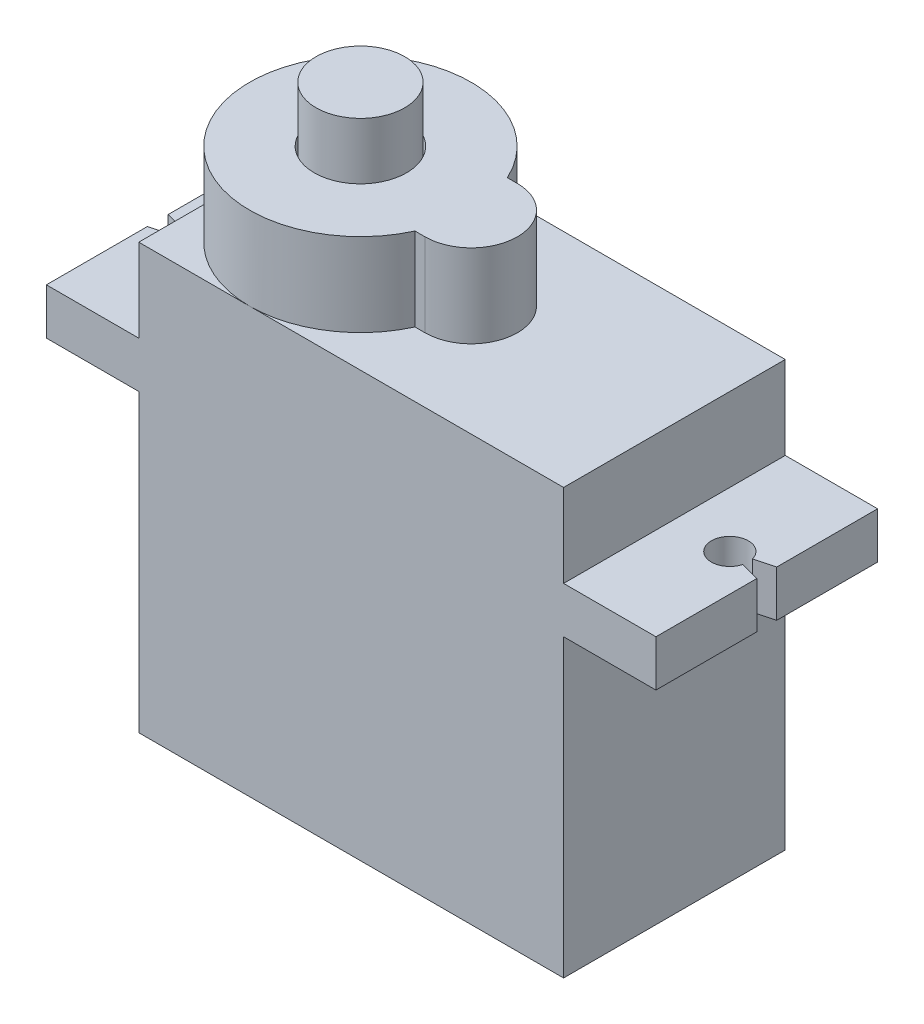
from build123d import *

# Parameters (mm, degrees)
SALIENTE_EXTRUIR1_DEPTH      = 6
SALIENTE_EXTRUIR1_DEPTH_BACK = 6
CROQUIS3_R                   = 2.5
SALIENTE_EXTRUIR2_DEPTH      = 4.5
CROQUIS4_R                   = 2.4
SALIENTE_EXTRUIR5_DEPTH      = 7.5
CORTAR_EXTRUIR1_DEPTH        = 3.5


with BuildPart() as part:
    # Croquis1 → Saliente-Extruir1 (new, two sides: drawn at the far end of the back side and taken through both)
    with BuildSketch(Plane.XY.offset(-SALIENTE_EXTRUIR1_DEPTH_BACK)):
        Polygon((-11.5, 7), (-16.5, 7), (-16.5, 4.5), (-11.5, 4.5), (-11.5, -11.5), (11.5, -11.5), (11.5, 4.5), (16.5, 4.5), (16.5, 7), (11.5, 7), (11.5, 11.5), (-11.5, 11.5), align=None)
    extrude(amount=SALIENTE_EXTRUIR1_DEPTH + SALIENTE_EXTRUIR1_DEPTH_BACK)

    # Croquis3 → Saliente-Extruir2 (add)
    with BuildSketch(Plane(origin=(0, 11.5, 0), x_dir=(1, 0, 0), z_dir=(0, 1, 0))):
        with BuildLine():
            Line((0.5, 2.5), (-0.045643943, 2.5))
            ThreePointArc((-0.045643943, 2.5), (-11.5, 0), (-0.045643943, -2.5))
            Line((-0.045643943, -2.5), (0.5, -2.5))
            ThreePointArc((0.5, -2.5), (3, 0), (0.5, 2.5))
        make_face()
        with Locations((-5.5, 0)):
            Circle(CROQUIS3_R, mode=Mode.SUBTRACT)
    extrude(amount=SALIENTE_EXTRUIR2_DEPTH)

    # Croquis4 → Saliente-Extruir5 (add)
    with BuildSketch(Plane(origin=(0, 11.5, 0), x_dir=(1, 0, 0), z_dir=(0, 1, 0))):
        with Locations((-5.5, 0)):
            Circle(CROQUIS4_R)
    extrude(amount=SALIENTE_EXTRUIR5_DEPTH)

    # Croquis6 → Cortar-Extruir1 (cut)
    with BuildSketch(Plane(origin=(0, 7, 0), x_dir=(1, 0, 0), z_dir=(0, 1, 0))):
        with BuildLine():
            Line((-16.5, 0.59249524), (-16.5, -0.535898385))
            Line((-16.5, -0.535898385), (-15.434038365, -0.250274826))
            ThreePointArc((-15.434038365, -0.250274826), (-13.489741501, 0.12166281), (-15.45994605, 0.313813624))
            Line((-15.45994605, 0.313813624), (-16.5, 0.59249524))
        make_face()
        with BuildLine():
            Line((15.465925826, 0.258819045), (16.5, 0.535898385))
            Line((16.5, 0.535898385), (16.5, -0.535898385))
            Line((16.5, -0.535898385), (15.465925826, -0.258819045))
            ThreePointArc((15.465925826, -0.258819045), (13.5, 0), (15.465925826, 0.258819045))
        make_face()
    extrude(amount=-CORTAR_EXTRUIR1_DEPTH, mode=Mode.SUBTRACT)


solid = part.part
